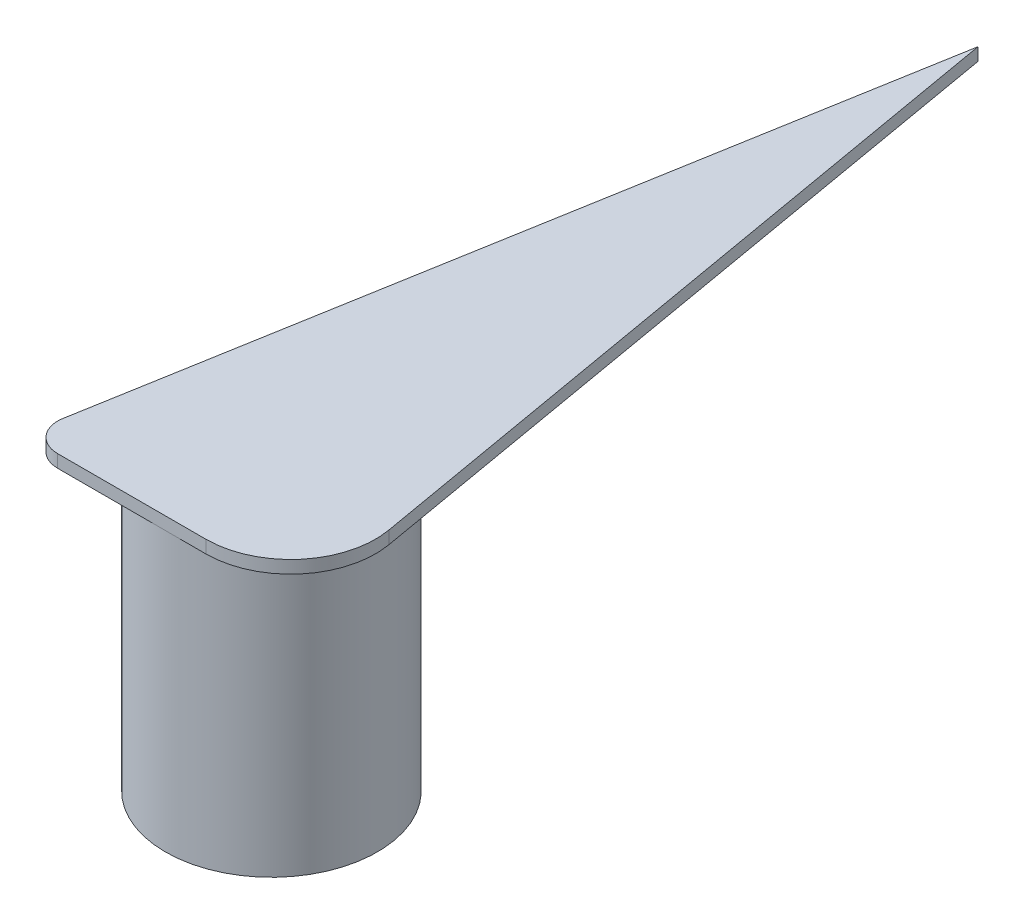
from build123d import *

# Parameters (mm, degrees)
SKETCH1_R           = 7.5
BOSS_EXTRUDE1_DEPTH = 1.8
BOSS_EXTRUDE2_START = -18.8
SKETCH1_3_R         = 7.5
BOSS_EXTRUDE2_DEPTH = 18.8
BOSS_EXTRUDE3_DEPTH = 0.9
FILLET1_R           = 6
FILLET2_R           = 2


with BuildPart() as part:
    # Sketch1 → Boss-Extrude1 (new body)
    with BuildSketch(Plane(origin=(0, 0, 0), x_dir=(1, 0, 0), z_dir=(0, 1, 0))):
        Circle(SKETCH1_R)
    extrude(amount=BOSS_EXTRUDE1_DEPTH)

    # Sketch1<3> → Boss-Extrude2 (add)
    with BuildSketch(Plane(origin=(0, 0, 0), x_dir=(1, 0, 0), z_dir=(0, 1, 0)).offset(BOSS_EXTRUDE2_START)):
        Circle(SKETCH1_3_R)
    extrude(amount=BOSS_EXTRUDE2_DEPTH)

    # Sketch3 → Boss-Extrude3 (add)
    with BuildSketch(Plane(origin=(0, 1.8, 0), x_dir=(1, 0, 0), z_dir=(0, 1, 0))):
        Polygon((0, 50), (-10, -7.5), (10, -7.5), align=None)
    extrude(amount=-BOSS_EXTRUDE3_DEPTH)

    # Fillet1
    fillet1_edges = [part.edges().sort_by_distance(p)[0] for p in [
        (10, 1.35, 7.5),
    ]]
    fillet(fillet1_edges, radius=FILLET1_R)

    # Fillet2
    fillet2_edges = [part.edges().sort_by_distance(p)[0] for p in [
        (-10, 1.35, 7.5),
    ]]
    fillet(fillet2_edges, radius=FILLET2_R)


solid = part.part
